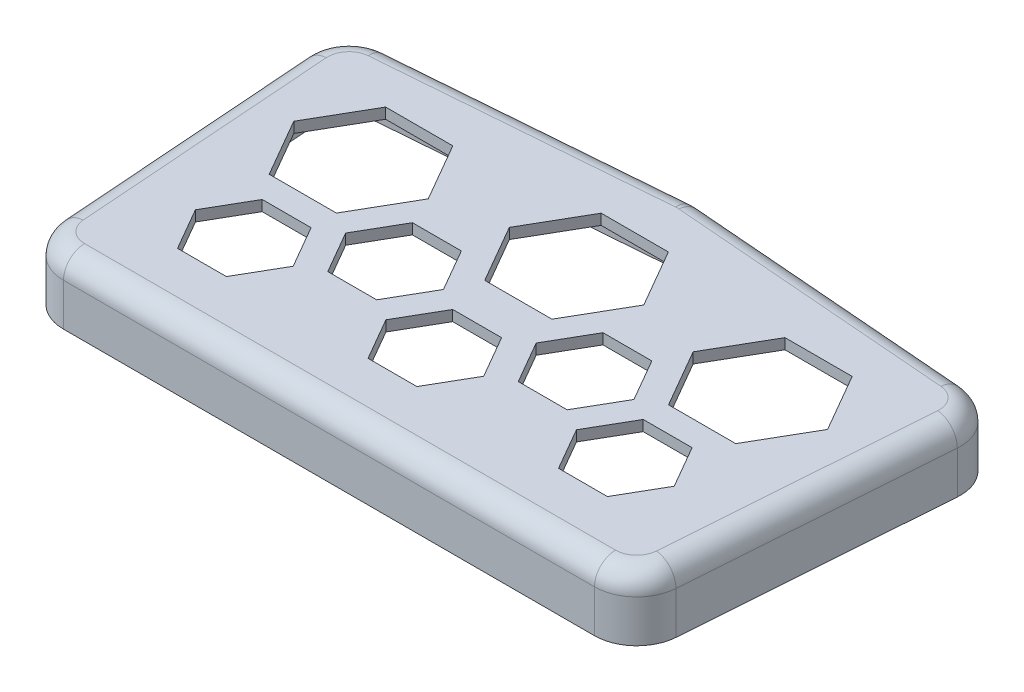
from build123d import *

# Parameters (mm, degrees)
BOSS_EXTRUDE1_DEPTH     = 38.1
FILLET1_R               = 25.4
FILLET2_R               = 12.7
SHELL1_T                = -6.35
CUT_EXTRUDE1_DEPTH      = 255.858427337
CUT_EXTRUDE1_DEPTH_BACK = 255.858427337


with BuildPart() as part:
    # Sketch1 → Boss-Extrude1 (new body)
    with BuildSketch(Plane(origin=(0, 0, 0), x_dir=(1, 0, 0), z_dir=(0, 1, 0))):
        Polygon((-114.3, -63.5), (114.3, -63.5), (182.894154879, -63.5), (187.132137575, -5.303806299), (197.900067, 142.561947658), (0, 158.296586732), (-197.900067, 142.561947658), (-187.132137575, -5.303806299), (-182.894154879, -63.5), align=None)
    extrude(amount=BOSS_EXTRUDE1_DEPTH)

    # Fillet1
    fillet1_edges = [part.edges().sort_by_distance(p)[0] for p in [
        (-182.894154879, 19.05, 63.5),
        (-197.900067, 19.05, -142.561947658),
        (0, 19.05, -158.296586732),
        (197.900067, 19.05, -142.561947658),
        (182.894154879, 19.05, 63.5),
    ]]
    fillet(fillet1_edges, radius=FILLET1_R)

    # Fillet2
    fillet2_edges = [part.edges().sort_by_distance(p)[0] for p in [
        (190.338493083, 38.1, -38.72603044),
        (0, 38.1, 63.5),
        (87.380434893, 38.1, -151.349142873),
        (-87.380434893, 38.1, -151.349142873),
        (-190.338493083, 38.1, -38.72603044),
        (-190.007212355, 38.1, -135.786308877),
        (0, 38.1, -158.216429875),
        (-176.572564505, 38.1, 56.70131683),
        (190.007212355, 38.1, -135.786308877),
        (176.572564505, 38.1, 56.70131683),
    ]]
    fillet(fillet2_edges, radius=FILLET2_R)

    # Shell1
    shell1_openings = [part.faces().sort_by_distance(p)[0] for p in [
        (0, 0, -44.95160626),
    ]]
    offset(amount=SHELL1_T, openings=shell1_openings, kind=Kind.INTERSECTION)

    # Sketch3 → Cut-Extrude1 (cut, two sides: drawn at the far end of the back side and taken through both)
    with BuildSketch(Plane(origin=(0, 38.1, 0), x_dir=(1, 0, 0), z_dir=(0, 1, 0)).offset(-CUT_EXTRUDE1_DEPTH_BACK)):
        Polygon((-128.964696837, 25.4), (-143.629393675, 0), (-128.964696837, -25.4), (-99.635303163, -25.4), (-84.970606325, 0), (-99.635303163, 25.4), align=None)
        Polygon((-27.820606325, 32.995567884), (-42.485303163, 58.395567884), (-71.814696837, 58.395567884), (-86.479393675, 32.995567884), (-71.814696837, 7.595567884), (-42.485303163, 7.595567884), align=None)
        Polygon((40.327916303, 85.041135768), (20.163958151, 119.966135768), (-20.163958151, 119.966135768), (-40.327916303, 85.041135768), (-20.163958151, 50.116135768), (20.163958151, 50.116135768), align=None)
        Polygon((29.329393675, 0), (14.664696837, 25.4), (-14.664696837, 25.4), (-29.329393675, 0), (-14.664696837, -25.4), (14.664696837, -25.4), align=None)
        Polygon((143.629393675, 0), (128.964696837, 25.4), (99.635303163, 25.4), (84.970606325, 0), (99.635303163, -25.4), (128.964696837, -25.4), align=None)
        Polygon((71.814696837, 7.595567884), (86.479393675, 32.995567884), (71.814696837, 58.395567884), (42.485303163, 58.395567884), (27.820606325, 32.995567884), (42.485303163, 7.595567884), align=None)
        Polygon((-99.635303163, 40.591135768), (-79.471345011, 75.516135768), (-99.635303163, 110.441135768), (-139.963219465, 110.441135768), (-160.127177617, 75.516135768), (-139.963219465, 40.591135768), align=None)
        Polygon((160.127177617, 75.516135768), (139.963219465, 110.441135768), (99.635303163, 110.441135768), (79.471345011, 75.516135768), (99.635303163, 40.591135768), (139.963219465, 40.591135768), align=None)
    extrude(amount=CUT_EXTRUDE1_DEPTH + CUT_EXTRUDE1_DEPTH_BACK, mode=Mode.SUBTRACT)


solid = part.part
